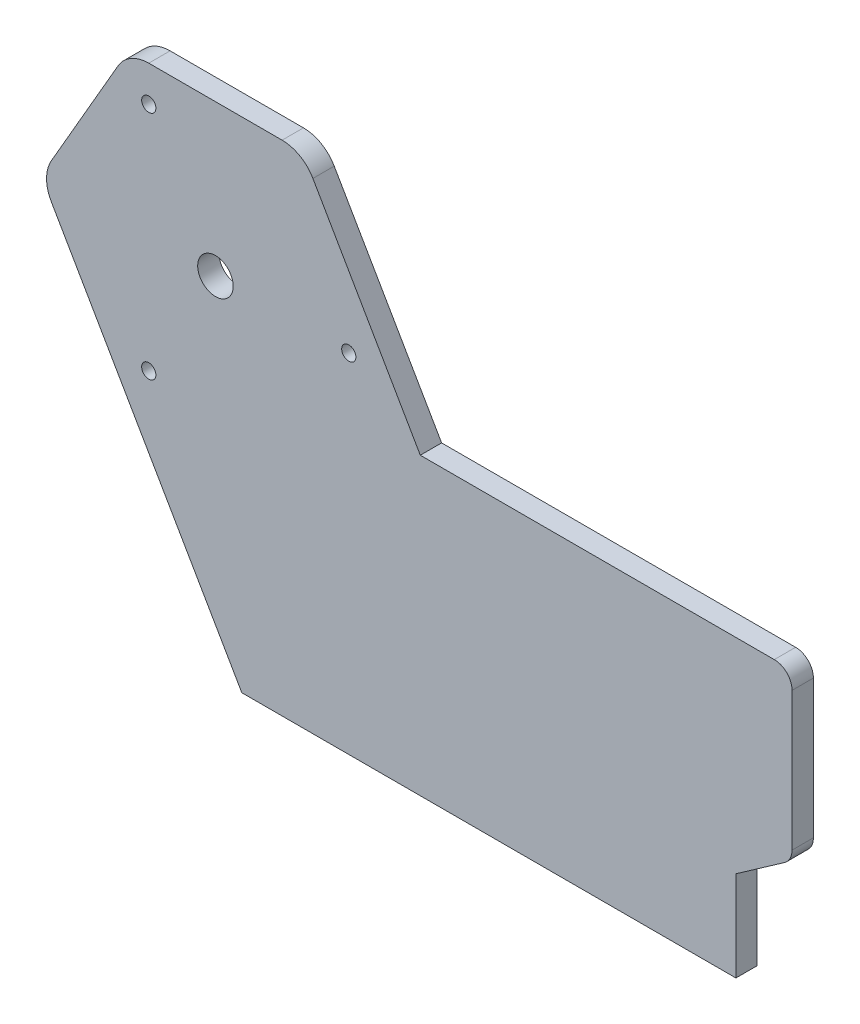
from build123d import *

# Parameters (mm, degrees)
SKETCH1_R           = 2
SKETCH1_R_2         = 5
BOSS_EXTRUDE1_DEPTH = 6


with BuildPart() as part:
    # Sketch1 → Boss-Extrude1 (new body)
    with BuildSketch(Plane.XY):
        with BuildLine():
            Line((-122.652649312, 114.845498823), (-69.048275573, 22))
            Line((-69.048275573, 22), (70, 22))
            Line((70, 22), (70, 47.4))
            Line((70, 47.4), (83.667882182, 56.970354135))
            ThreePointArc((83.667882182, 56.970354135), (85.235054166, 58.75737129), (85.8, 61.066114356))
            Line((85.8, 61.066114356), (85.8, 100))
            ThreePointArc((85.8, 100), (84.335533906, 103.535533906), (80.8, 105))
            Line((80.8, 105), (-18.818802154, 105))
            Line((-18.818802154, 105), (-49.04048999, 157.345498823))
            ThreePointArc((-49.04048999, 157.345498823), (-52.700744028, 161.005752861), (-57.700744028, 162.345498823))
            Line((-57.700744028, 162.345498823), (-95.228511525, 162.345498823))
            ThreePointArc((-95.228511525, 162.345498823), (-100.228511525, 161.005752861), (-103.888765563, 157.345498823))
            Line((-103.888765563, 157.345498823), (-122.652649312, 124.845498823))
            ThreePointArc((-122.652649312, 124.845498823), (-123.992395274, 119.845498823), (-122.652649312, 114.845498823))
        make_face()
        with Locations((-95.228511525, 87.345498823)):
            Circle(SKETCH1_R, mode=Mode.SUBTRACT)
        with Locations((-38.936860279, 119.845498823)):
            Circle(SKETCH1_R, mode=Mode.SUBTRACT)
        with Locations((-76.464627777, 119.845498823)):
            Circle(SKETCH1_R_2, mode=Mode.SUBTRACT)
        with Locations((-95.228511525, 152.345498823)):
            Circle(SKETCH1_R, mode=Mode.SUBTRACT)
    extrude(amount=BOSS_EXTRUDE1_DEPTH)


solid = part.part
